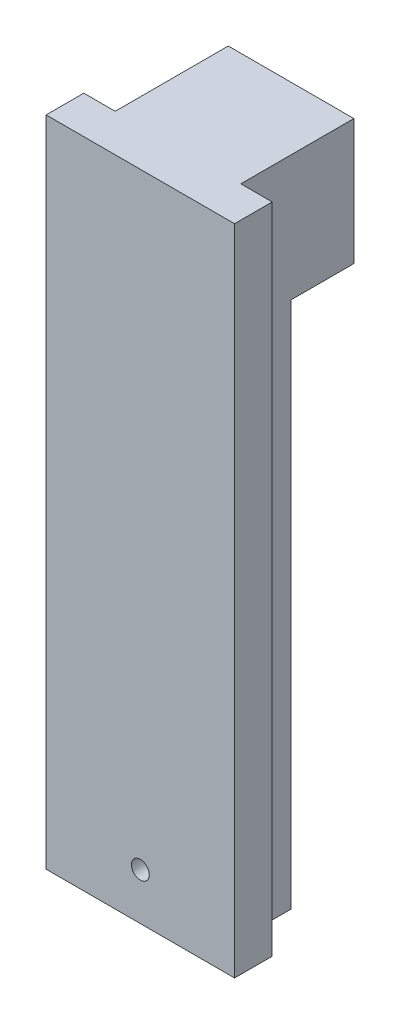
from build123d import *

# Parameters (mm, degrees)
DODANIE_WYCI_GNI_CIE1_DEPTH = 104
SZKIC2_W                    = 20
SZKIC2_H                    = 20
DODANIE_WYCI_GNI_CIE2_DEPTH = 10
SZKIC3_R                    = 2.5
WYTNIJ_WYCI_GNI_CIE1_DEPTH  = 10
SZKIC4_R                    = 1.425
WYTNIJ_WYCI_GNI_CIE2_DEPTH  = 108.782187768


with BuildPart() as part:
    # Szkic1 → Dodanie-wyciągnięcie1 (new body)
    with BuildSketch(Plane(origin=(0, 0, 0), x_dir=(1, 0, 0), z_dir=(0, 1, 0))):
        Polygon((-15, 0), (15, 0), (15, 6), (10, 6), (10, 14), (-10, 14), (-10, 6), (-15, 6), align=None)
    extrude(amount=DODANIE_WYCI_GNI_CIE1_DEPTH)

    # Szkic2 → Dodanie-wyciągnięcie2 (add)
    with BuildSketch(Plane(origin=(0, 0, -14), x_dir=(-1, 0, 0), z_dir=(0, 0, -1))):
        with Locations((0, 94)):
            Rectangle(SZKIC2_W, SZKIC2_H)
    extrude(amount=DODANIE_WYCI_GNI_CIE2_DEPTH)

    # Szkic3 → Wytnij-wyciągnięcie1 (cut)
    with BuildSketch(Plane(origin=(0, 0, -24), x_dir=(-1, 0, 0), z_dir=(0, 0, -1))):
        with Locations((0, 94)):
            Circle(SZKIC3_R)
    extrude(amount=-WYTNIJ_WYCI_GNI_CIE1_DEPTH, mode=Mode.SUBTRACT)

    # Szkic4 → Wytnij-wyciągnięcie2 (cut, through all)
    with BuildSketch(Plane.XY):
        with Locations((0, 7.425)):
            Circle(SZKIC4_R)
    extrude(amount=-WYTNIJ_WYCI_GNI_CIE2_DEPTH, mode=Mode.SUBTRACT)


solid = part.part
